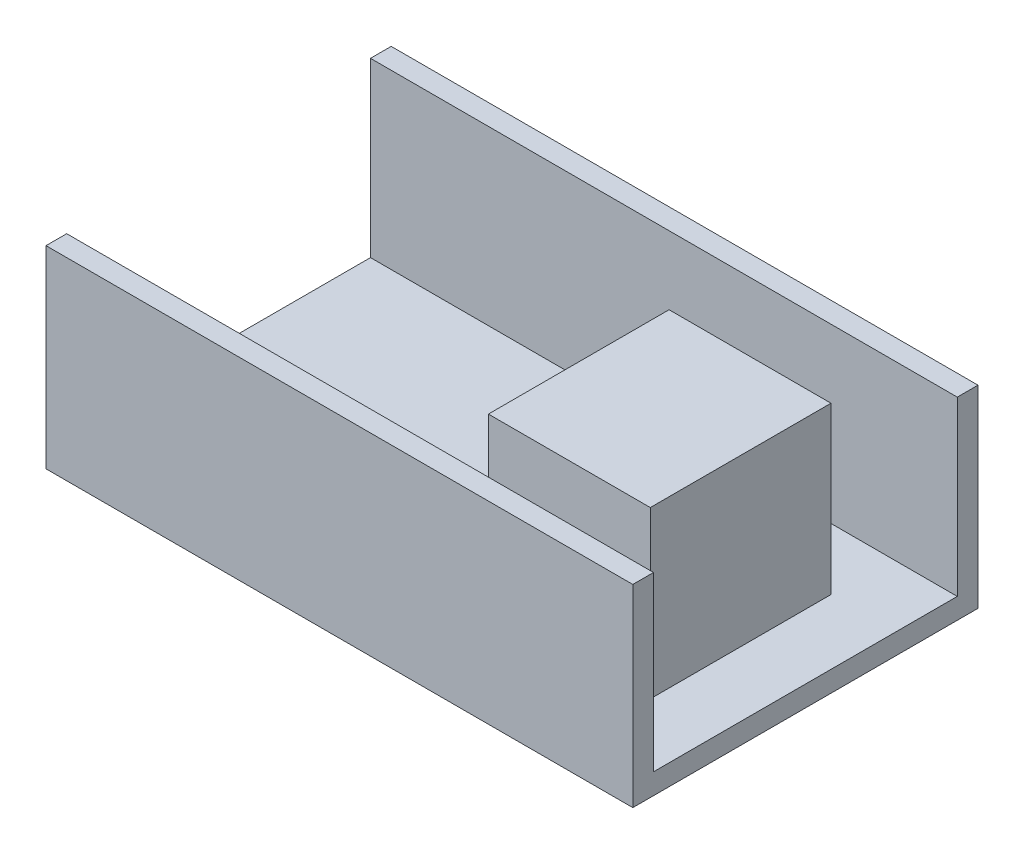
from build123d import *

# Parameters (mm, degrees)
EXTRUDE_1_DEPTH   = 42.5
SKETCH_2_W        = 23.452329067
SKETCH_2_H        = 26.173759744
EXTRUDE_1_2_DEPTH = 24


with BuildPart() as part:
    # 草图1 → Extrude 1 (new, symmetric)
    with BuildSketch(Plane(origin=(0, 0, 0), x_dir=(0, 0, -1), z_dir=(1, 0, 0))):
        Polygon((25, 28), (25, 0), (-25, 0), (-25, 28), (-22, 28), (-22, 3), (22, 3), (22, 28), align=None)
    extrude(amount=EXTRUDE_1_DEPTH, both=True)

    # 草图2 → Extrude 1 2 (add)
    with BuildSketch(Plane(origin=(0, 3, 0), x_dir=(1, 0, 0), z_dir=(0, 1, 0))):
        with Locations((21.393325716, 0)):
            Rectangle(SKETCH_2_W, SKETCH_2_H)
    extrude(amount=EXTRUDE_1_2_DEPTH)


solid = part.part
